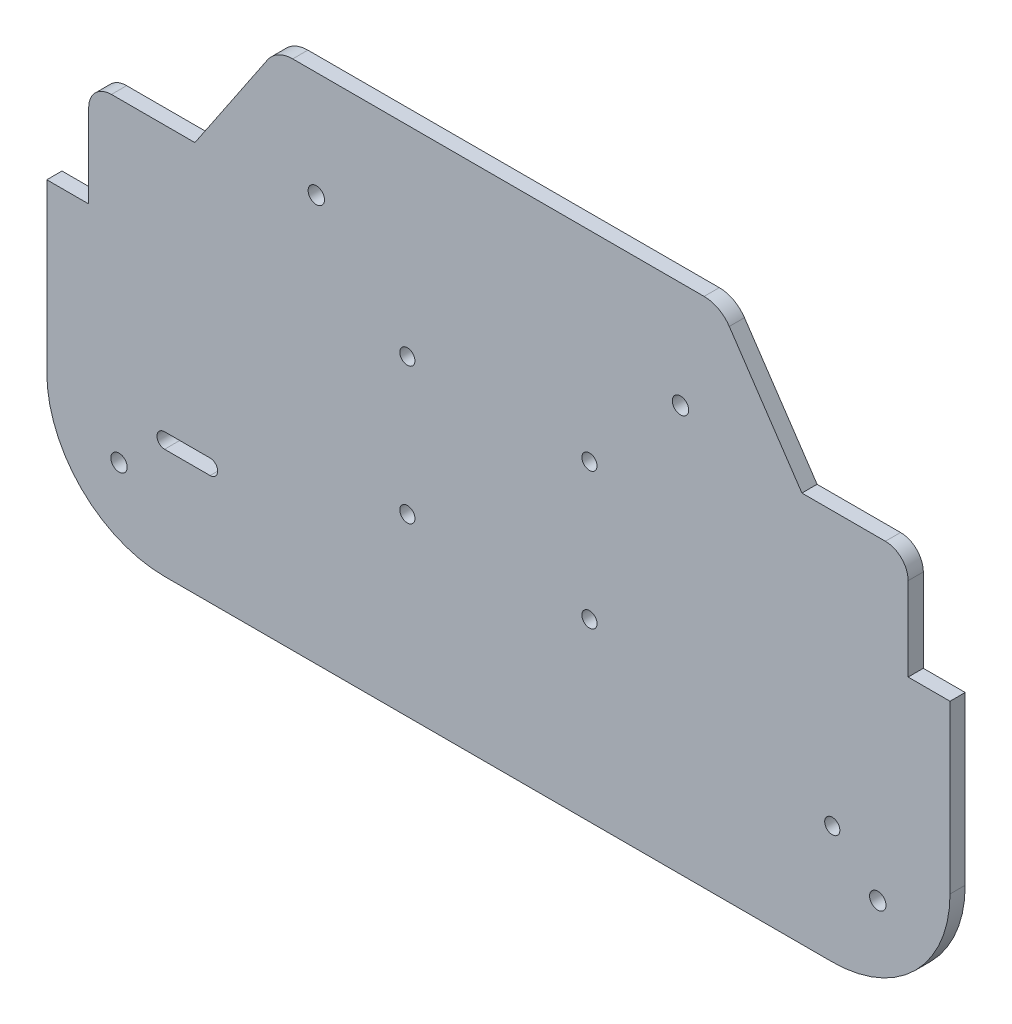
from build123d import *

# Parameters (mm, degrees)
SKETCH1_R           = 1.7145
SKETCH1_R_2         = 1.5875
BOSS_EXTRUDE1_DEPTH = 3.175
FILLET1_R           = 6.35


with BuildPart() as part:
    # Sketch1 → Boss-Extrude1 (new body)
    with BuildSketch(Plane.XY.offset(-196.85)):
        with BuildLine():
            Line((63.5, -114.3), (46.418820715, -88.9))
            Line((46.418820715, -88.9), (-46.418820715, -88.9))
            Line((-46.418820715, -88.9), (-63.5, -114.3))
            Line((-63.5, -114.3), (-80.9625, -114.3))
            ThreePointArc((-80.9625, -114.3), (-84.330096045, -115.694903955), (-85.725, -119.0625))
            Line((-85.725, -119.0625), (-85.725, -136.525))
            Line((-85.725, -136.525), (-94.488, -136.525))
            Line((-94.488, -136.525), (-94.488, -171.45))
            ThreePointArc((-94.488, -171.45), (-87.271696875, -188.871696875), (-69.85, -196.088))
            Line((-69.85, -196.088), (69.85, -196.088))
            ThreePointArc((69.85, -196.088), (87.271696875, -188.871696875), (94.488, -171.45))
            Line((94.488, -171.45), (94.488, -136.525))
            Line((94.488, -136.525), (85.725, -136.525))
            Line((85.725, -136.525), (85.725, -119.0625))
            ThreePointArc((85.725, -119.0625), (84.330096045, -115.694903955), (80.9625, -114.3))
            Line((80.9625, -114.3), (63.5, -114.3))
        make_face()
        with Locations((-79.375, -180.213)):
            Circle(SKETCH1_R, mode=Mode.SUBTRACT)
        with BuildLine():
            ThreePointArc((-69.85, -173.0375), (-71.4375, -171.45), (-69.85, -169.8625))
            Line((-69.85, -169.8625), (-60.325, -169.8625))
            ThreePointArc((-60.325, -169.8625), (-58.7375, -171.45), (-60.325, -173.0375))
            Line((-60.325, -173.0375), (-69.85, -173.0375))
        make_face(mode=Mode.SUBTRACT)
        with Locations((-19.05, -159.40600326)):
            Circle(SKETCH1_R_2, mode=Mode.SUBTRACT)
        with Locations((-19.05, -130.83100326)):
            Circle(SKETCH1_R_2, mode=Mode.SUBTRACT)
        with Locations((-38.1, -111.125)):
            Circle(SKETCH1_R, mode=Mode.SUBTRACT)
        with Locations((19.05, -159.40600326)):
            Circle(SKETCH1_R_2, mode=Mode.SUBTRACT)
        with Locations((79.375, -180.213)):
            Circle(SKETCH1_R, mode=Mode.SUBTRACT)
        with Locations((69.85, -171.45)):
            Circle(SKETCH1_R_2, mode=Mode.SUBTRACT)
        with Locations((19.05, -130.83100326)):
            Circle(SKETCH1_R_2, mode=Mode.SUBTRACT)
        with Locations((38.1, -111.125)):
            Circle(SKETCH1_R, mode=Mode.SUBTRACT)
    extrude(amount=-BOSS_EXTRUDE1_DEPTH)

    # Fillet1
    fillet1_edges = [part.edges().sort_by_distance(p)[0] for p in [
        (46.418820715, -88.9, -198.4375),
        (-46.418820715, -88.9, -198.4375),
    ]]
    fillet(fillet1_edges, radius=FILLET1_R)


solid = part.part
